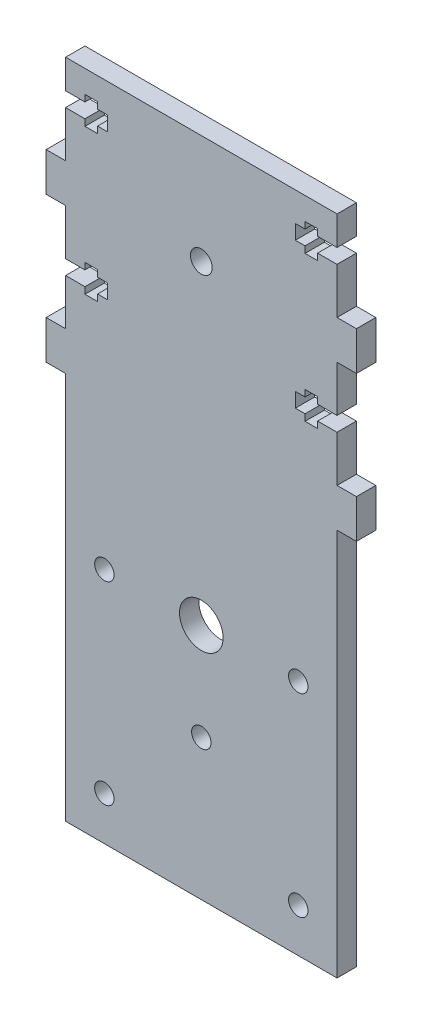
from build123d import *

# Parameters (mm, degrees)
SKETCH_1_R      = 2.25
SKETCH_1_R_2    = 4.5
SKETCH_1_R_3    = 2
EXTRUDE_1_DEPTH = 4


with BuildPart() as part:
    # 草图1 → 凸台-拉伸1 (new body)
    with BuildSketch(Plane.XY):
        Polygon((0, 4.863043478), (-4, 4.863043478), (-4, 12.863043478), (0, 12.863043478), (0, 22.363043478), (4, 22.363043478), (4, 21.013043478), (6.6, 21.013043478), (6.6, 22.363043478), (8.6, 22.363043478), (8.6, 25.363043478), (6.6, 25.363043478), (6.6, 26.713043478), (4, 26.713043478), (4, 25.363043478), (0, 25.363043478), (0, 31.363043478), (56, 31.363043478), (56, 25.363043478), (52, 25.363043478), (52, 26.713043478), (49.4, 26.713043478), (49.4, 25.363043478), (47.4, 25.363043478), (47.4, 22.363043478), (49.4, 22.363043478), (49.4, 21.013043478), (52, 21.013043478), (52, 22.363043478), (56, 22.363043478), (56, 12.863043478), (60, 12.863043478), (60, 4.863043478), (56, 4.863043478), (56, -4.636956522), (52, -4.636956522), (52, -3.286956522), (49.4, -3.286956522), (49.4, -4.636956522), (47.4, -4.636956522), (47.4, -7.636956522), (49.4, -7.636956522), (49.4, -8.986956522), (52, -8.986956522), (52, -7.636956522), (56, -7.636956522), (56, -17.136956522), (60, -17.136956522), (60, -25.136956522), (56, -25.136956522), (56, -105.136956522), (0, -105.136956522), (0, -25.136956522), (-4, -25.136956522), (-4, -17.136956522), (0, -17.136956522), (0, -7.636956522), (4, -7.636956522), (4, -8.986956522), (6.6, -8.986956522), (6.6, -7.636956522), (8.6, -7.636956522), (8.6, -4.636956522), (6.6, -4.636956522), (6.6, -3.286956522), (4, -3.286956522), (4, -4.636956522), (0, -4.636956522), align=None)
        with Locations((28, 8.863043478)):
            Circle(SKETCH_1_R, mode=Mode.SUBTRACT)
        with Locations((28, -56.136956522)):
            Circle(SKETCH_1_R_2, mode=Mode.SUBTRACT)
        with Locations((8, -56.136956522)):
            Circle(SKETCH_1_R_3, mode=Mode.SUBTRACT)
        with Locations((28, -76.136956522)):
            Circle(SKETCH_1_R_3, mode=Mode.SUBTRACT)
        with Locations((48, -56.136956522)):
            Circle(SKETCH_1_R_3, mode=Mode.SUBTRACT)
        with Locations((48, -96.136956522)):
            Circle(SKETCH_1_R_3, mode=Mode.SUBTRACT)
        with Locations((8, -96.136956522)):
            Circle(SKETCH_1_R_3, mode=Mode.SUBTRACT)
    extrude(amount=EXTRUDE_1_DEPTH)


solid = part.part
